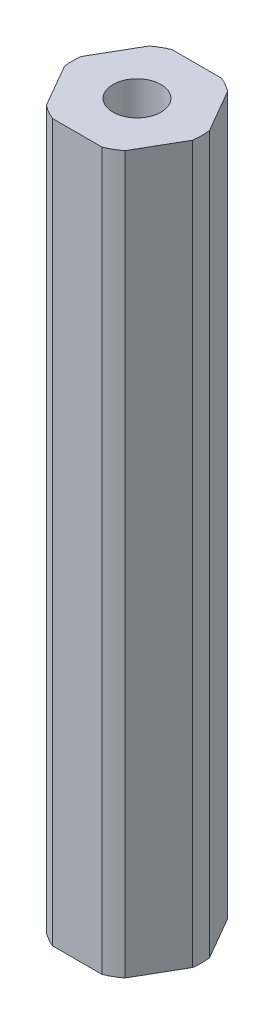
from build123d import *

# Parameters (mm, degrees)
SKETCH1_R           = 2.5527
BOSS_EXTRUDE1_DEPTH = 38.1


with BuildPart() as part:
    # Sketch1 → Boss-Extrude1 (new, symmetric)
    with BuildSketch(Plane(origin=(0, 0, 0), x_dir=(1, 0, 0), z_dir=(0, 1, 0))):
        with BuildLine():
            ThreePointArc((2.637015474, -6.35), (3.43789, -5.954600151), (4.180753577, -5.45872239))
            Line((4.180753577, -5.45872239), (6.817769051, -0.89127761))
            ThreePointArc((6.817769051, -0.89127761), (6.861261935, -0.446581753), (6.87578, 0))
            ThreePointArc((6.87578, 0), (6.861261935, 0.446581753), (6.817769051, 0.89127761))
            Line((6.817769051, 0.89127761), (4.180753577, 5.45872239))
            ThreePointArc((4.180753577, 5.45872239), (3.43789, 5.954600151), (2.637015474, 6.35))
            Line((2.637015474, 6.35), (-2.637015474, 6.35))
            ThreePointArc((-2.637015474, 6.35), (-3.43789, 5.954600151), (-4.180753577, 5.45872239))
            Line((-4.180753577, 5.45872239), (-6.817769051, 0.89127761))
            ThreePointArc((-6.817769051, 0.89127761), (-6.87578, 0), (-6.817769051, -0.89127761))
            Line((-6.817769051, -0.89127761), (-4.180753577, -5.45872239))
            ThreePointArc((-4.180753577, -5.45872239), (-3.43789, -5.954600151), (-2.637015474, -6.35))
            Line((-2.637015474, -6.35), (2.637015474, -6.35))
        make_face()
        with Locations(Location((0, 0, 0), (0, 0, 90))):
            Circle(SKETCH1_R, mode=Mode.SUBTRACT)
    extrude(amount=BOSS_EXTRUDE1_DEPTH, both=True)


solid = part.part
